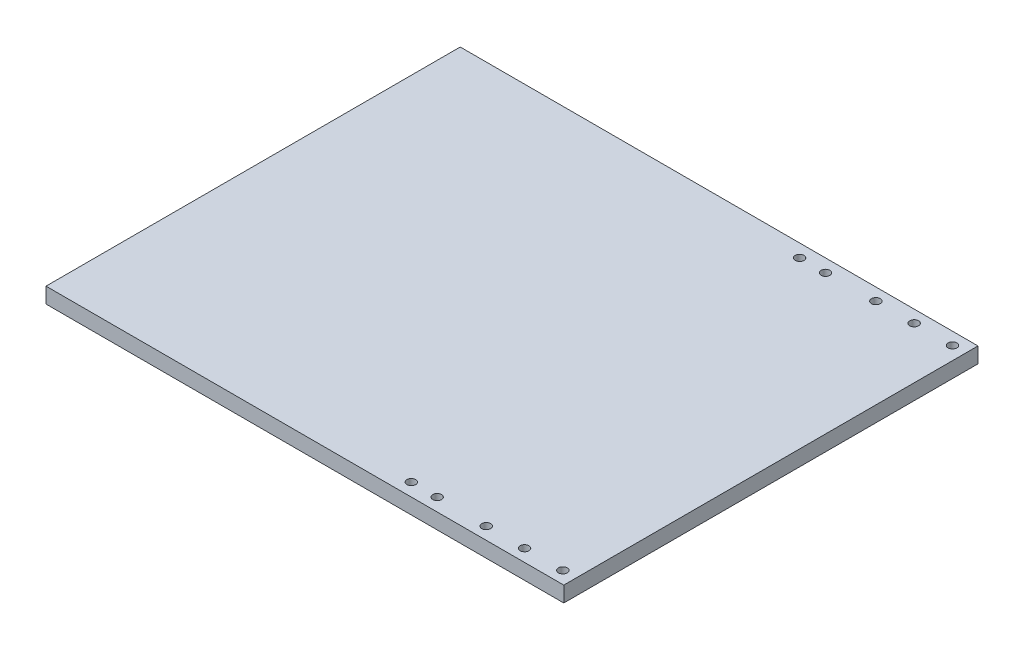
from build123d import *

# Parameters (mm, degrees)
SKETCH1_W            = 200
SKETCH1_H            = 160
BOSS_EXTRUDE1_DEPTH  = 6
M3_CLEARANCE_HOLE1_D = 3.4
M3_CLEARANCE_HOLE2_D = 3.4


with BuildPart() as part:
    # Sketch1 → Boss-Extrude1 (new body)
    with BuildSketch(Plane(origin=(0, 0, 0), x_dir=(1, 0, 0), z_dir=(0, 1, 0))):
        Rectangle(SKETCH1_W, SKETCH1_H)
    extrude(amount=BOSS_EXTRUDE1_DEPTH)

    # M3 Clearance Hole1 (through all)
    with Locations(Plane(origin=(0, 6, 0), x_dir=(1, 0, 0), z_dir=(0, 1, 0))):
        with Locations((36.1, -75), (46.1, -75), (36.1, 75), (46.1, 75)):
            Hole(M3_CLEARANCE_HOLE1_D / 2)

    # M3 Clearance Hole2 (through all)
    with Locations(Plane(origin=(0, 6, 0), x_dir=(1, 0, 0), z_dir=(0, 1, 0))):
        with Locations((94.9, -75.25), (80.1, -75.25), (65.3, -75.25), (94.9, 75.25), (80.1, 75.25), (65.3, 75.25)):
            Hole(M3_CLEARANCE_HOLE2_D / 2)


solid = part.part
